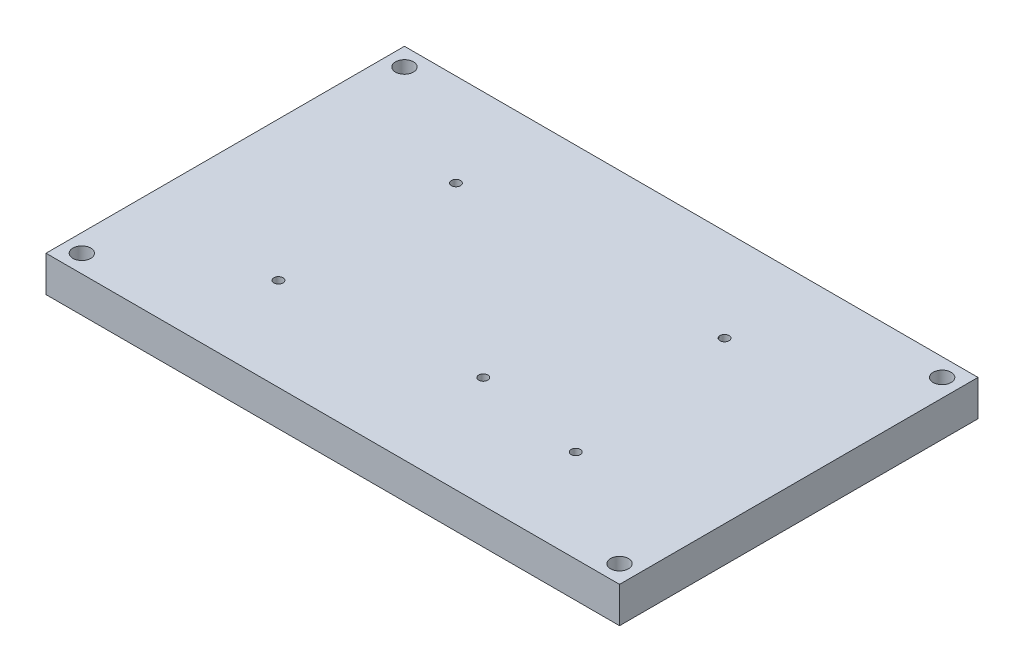
from build123d import *

# Parameters (mm, degrees)
ESQUISSE1_W             = 160
ESQUISSE1_H             = 100
ESQUISSE1_R             = 2.5
BOSS_EXTRU_1_DEPTH      = 10
ESQUISSE2_R             = 1.27
ENL_V_MAT_EXTRU_1_DEPTH = 189.944436277


with BuildPart() as part:
    # Esquisse1 → Boss.-Extru.1 (new body)
    with BuildSketch(Plane(origin=(0, 0, 0), x_dir=(1, 0, 0), z_dir=(0, 1, 0))):
        with Locations((80, 50)):
            Rectangle(ESQUISSE1_W, ESQUISSE1_H)
        with Locations(Location((5, 95, 0), (0, 0, 270))):
            Circle(ESQUISSE1_R, mode=Mode.SUBTRACT)
        with Locations(Location((5, 5, 0), (0, 0, 270))):
            Circle(ESQUISSE1_R, mode=Mode.SUBTRACT)
        with Locations(Location((155, 95, 0), (0, 0, 270))):
            Circle(ESQUISSE1_R, mode=Mode.SUBTRACT)
        with Locations(Location((155, 5, 0), (0, 0, 270))):
            Circle(ESQUISSE1_R, mode=Mode.SUBTRACT)
    extrude(amount=BOSS_EXTRU_1_DEPTH)

    # Esquisse2 → Enlèv. mat.-Extru.1 (cut, through all)
    with BuildSketch(Plane(origin=(0, 10, 0), x_dir=(1, 0, 0), z_dir=(0, 1, 0))):
        with Locations(Location((40.24, 74.13, 0), (0, 0, 270))):
            Circle(ESQUISSE2_R)
        with Locations(Location((38.97, 25.87, 0), (0, 0, 270))):
            Circle(ESQUISSE2_R)
        with Locations(Location((91.04, 30.95, 0), (0, 0, 270))):
            Circle(ESQUISSE2_R)
        with Locations(Location((121.92, 25.87, 0), (0, 0, 270))):
            Circle(ESQUISSE2_R)
        with Locations(Location((115.17, 74.13, 0), (0, 0, 270))):
            Circle(ESQUISSE2_R)
    extrude(amount=-ENL_V_MAT_EXTRU_1_DEPTH, mode=Mode.SUBTRACT)


solid = part.part
